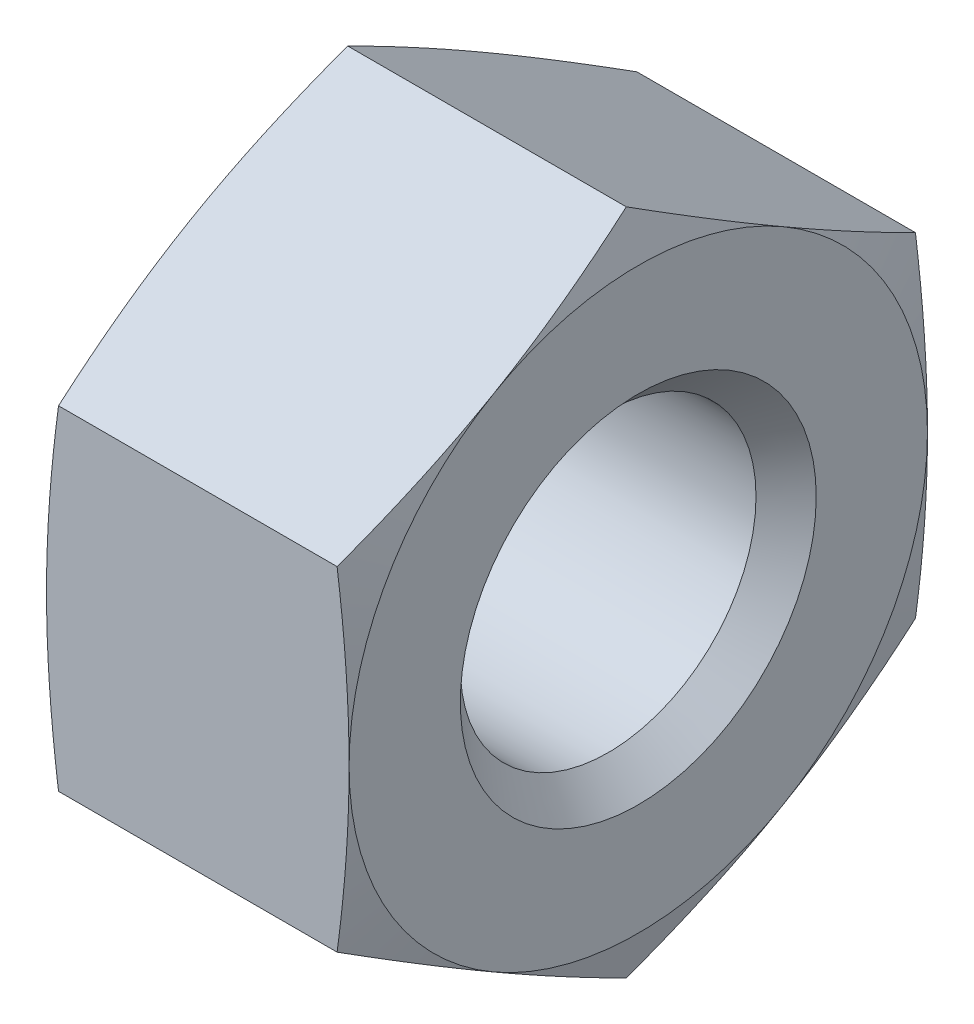
from build123d import *

# Parameters (mm, degrees)
ENL_V_MAT_EXTRU_1_DEPTH      = 7.8
ENL_V_MAT_EXTRU_1_DEPTH_BACK = 7.8
ESQUISSE2_W                  = 52
ESQUISSE2_H                  = 52
ESQUISSE3_R                  = 4.875
BOSS_EXTRU_1_DEPTH           = 3.4


with BuildPart() as part:
    # Esquisse1 → Révolution1 (revolve)
    with BuildSketch(Plane(origin=(0, 0, 0), x_dir=(1, 0, 0), z_dir=(0, 1, 0)), mode=Mode.PRIVATE) as r_volution1_sk:
        Polygon((0, -6.5), (3.4, -19.188972746), (6.8, -6.5), (6.8, -4), (6.1235, -3.3235), (0.6765, -3.3235), (0, -4), align=None)
    revolve(r_volution1_sk.sketch.rotate(Axis((0, 0, 0), (1, 0, 0)), 180), axis=Axis((0, 0, 0), (1, 0, 0)))

    # Esquisse2 → Enlèv. mat.-Extru.1 (cut, two sides: drawn at the far end of the back side and taken through both)
    with BuildSketch(Plane(origin=(0, 0, 0), x_dir=(0, 0, -1), z_dir=(1, 0, 0)).offset(-ENL_V_MAT_EXTRU_1_DEPTH_BACK)):
        Rectangle(ESQUISSE2_W, ESQUISSE2_H)
        Polygon((-6.5, -3.75277675), (0, -7.505553499), (6.5, -3.75277675), (6.5, 3.75277675), (0, 7.505553499), (-6.5, 3.75277675), align=None, mode=Mode.SUBTRACT)
    extrude(amount=ENL_V_MAT_EXTRU_1_DEPTH + ENL_V_MAT_EXTRU_1_DEPTH_BACK, mode=Mode.SUBTRACT)


with BuildPart() as body_2:
    # Esquisse3 → Boss.-Extru.1 (new body)
    with BuildSketch(Plane(origin=(0, 0, 0), x_dir=(0, 0, -1), z_dir=(1, 0, 0))):
        with Locations(Location((0, 0, 0), (0, 0, 180))):
            Circle(ESQUISSE3_R)
    extrude(amount=BOSS_EXTRU_1_DEPTH)

    # SupprimerFace1: 1 face struck out; the rest of the skin is kept as a surface, the solid goes
    supprimerface1_1_drop = [body_2.part.faces().sort_by_distance(Vector(p))[0] for p in ((3.4, 0, 0),)]
    supprimerface1_1 = Shell(body_2.part.faces() - supprimerface1_1_drop)


solid = part.part
